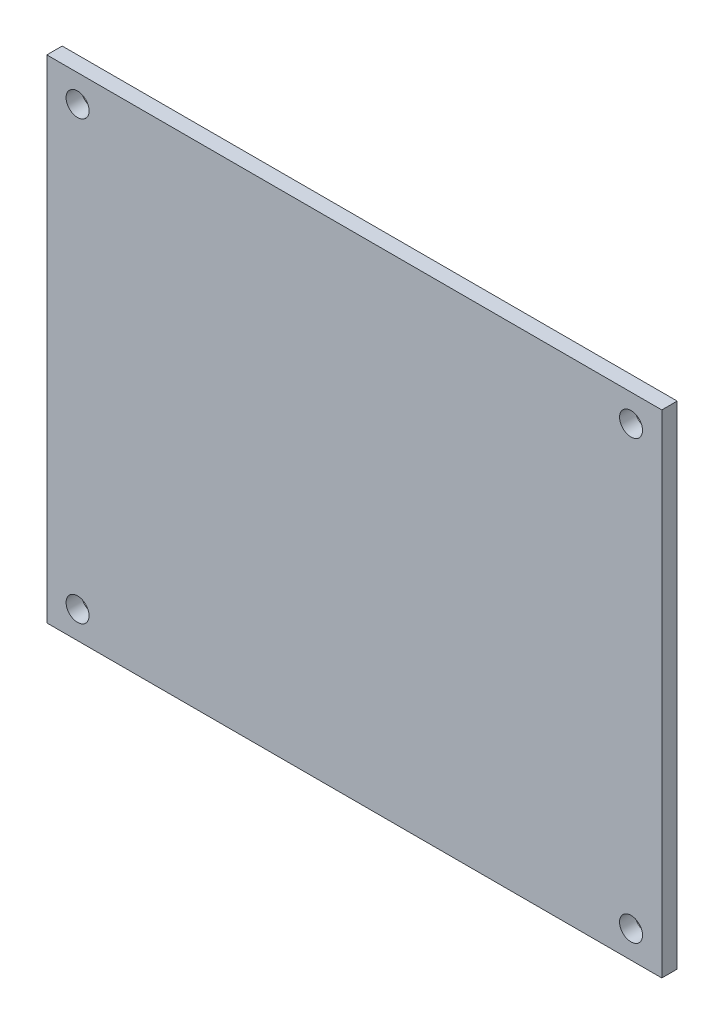
from build123d import *

# Parameters (mm, degrees)
SKETCH1_W           = 254
SKETCH1_H           = 203.2
BOSS_EXTRUDE1_DEPTH = 6.35
SKETCH2_R           = 4.7498
CUT_EXTRUDE2_DEPTH  = 6.35


with BuildPart() as part:
    # Sketch1 → Boss-Extrude1 (new body)
    with BuildSketch(Plane.XY):
        Rectangle(SKETCH1_W, SKETCH1_H)
    extrude(amount=BOSS_EXTRUDE1_DEPTH)

    # Sketch2 → Cut-Extrude2 (cut)
    with BuildSketch(Plane.XY.offset(6.35)):
        with Locations((114.3, -90.297)):
            Circle(SKETCH2_R)
        with Locations(Location((-114.3, -90.297, 0), (0, 0, 180))):
            Circle(SKETCH2_R)
        with Locations(Location((114.3, 90.297, 0), (0, 0, 180))):
            Circle(SKETCH2_R)
        with Locations((-114.3, 90.297)):
            Circle(SKETCH2_R)
    extrude(amount=-CUT_EXTRUDE2_DEPTH, mode=Mode.SUBTRACT)


solid = part.part
